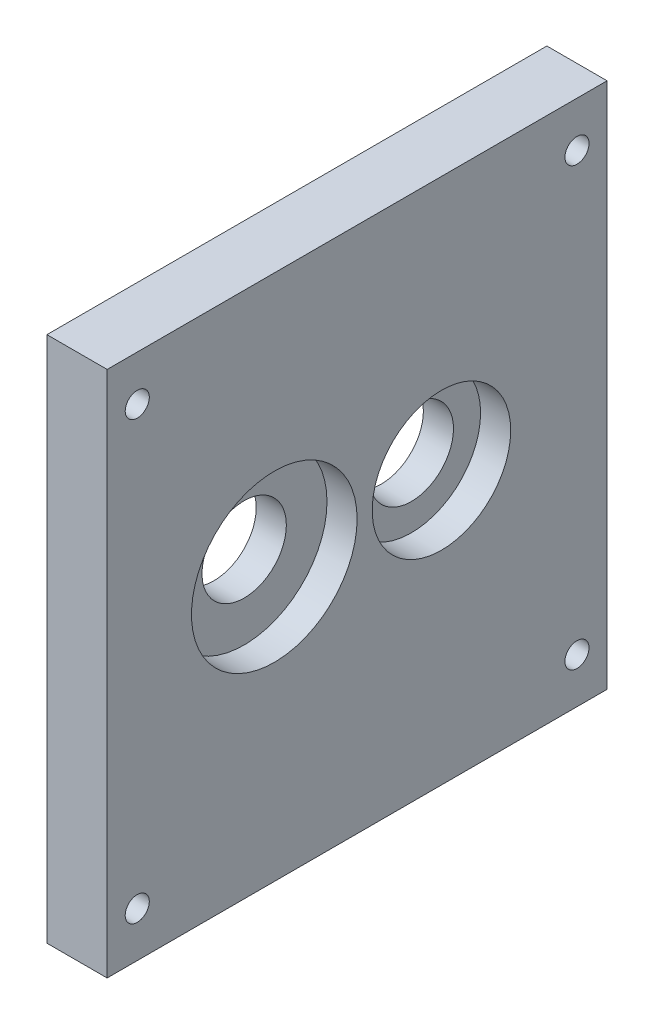
from build123d import *

# Parameters (mm, degrees)
SKETCH1_W           = 20
SKETCH1_H           = 166
BOSS_EXTRUDE1_DEPTH = 175
SKETCH2_R           = 14
CUT_EXTRUDE1_DEPTH  = 175
SKETCH3_R           = 27.5
SKETCH3_R_2         = 23
CUT_EXTRUDE2_DEPTH  = 10
SKETCH4_R           = 4
CUT_EXTRUDE3_DEPTH  = 195.715176604
SKETCH5_R           = 4
CUT_EXTRUDE4_DEPTH  = 15


with BuildPart() as part:
    # Sketch1 → Boss-Extrude1 (new body)
    with BuildSketch(Plane(origin=(0, 0, 0), x_dir=(1, 0, 0), z_dir=(0, 1, 0))):
        Rectangle(SKETCH1_W, SKETCH1_H)
    extrude(amount=BOSS_EXTRUDE1_DEPTH)

    # Sketch2 → Cut-Extrude1 (cut)
    with BuildSketch(Plane(origin=(10, 0, 0), x_dir=(0, 0, -1), z_dir=(1, 0, 0))):
        with Locations((-27.5, 90.5)):
            Circle(SKETCH2_R)
        with Locations((28, 90.5)):
            Circle(SKETCH2_R)
    extrude(amount=-CUT_EXTRUDE1_DEPTH, mode=Mode.SUBTRACT)

    # Sketch3 → Cut-Extrude2 (cut)
    with BuildSketch(Plane(origin=(10, 0, 0), x_dir=(0, 0, -1), z_dir=(1, 0, 0))):
        with Locations((-27.5, 90.5)):
            Circle(SKETCH3_R)
        with Locations((28, 90.5)):
            Circle(SKETCH3_R_2)
    extrude(amount=-CUT_EXTRUDE2_DEPTH, mode=Mode.SUBTRACT)

    # Sketch4 → Cut-Extrude3 (cut, through all)
    with BuildSketch(Plane(origin=(10, 0, 0), x_dir=(0, 0, -1), z_dir=(1, 0, 0))):
        with Locations((73, 160)):
            Circle(SKETCH4_R)
        with Locations(Location((73, 15, 0), (0, 0, 180))):
            Circle(SKETCH4_R)
        with Locations((-73, 15)):
            Circle(SKETCH4_R)
        with Locations(Location((-73, 160, 0), (0, 0, 180))):
            Circle(SKETCH4_R)
    extrude(amount=-CUT_EXTRUDE3_DEPTH, mode=Mode.SUBTRACT)

    # Sketch5 → Cut-Extrude4 (cut)
    with BuildSketch(Plane.XZ):
        with Locations(Location((0, -50, 0), (0, 0, 270))):
            Circle(SKETCH5_R)
        with Locations(Location((0, 50, 0), (0, 0, 90))):
            Circle(SKETCH5_R)
    extrude(amount=-CUT_EXTRUDE4_DEPTH, mode=Mode.SUBTRACT)


solid = part.part
